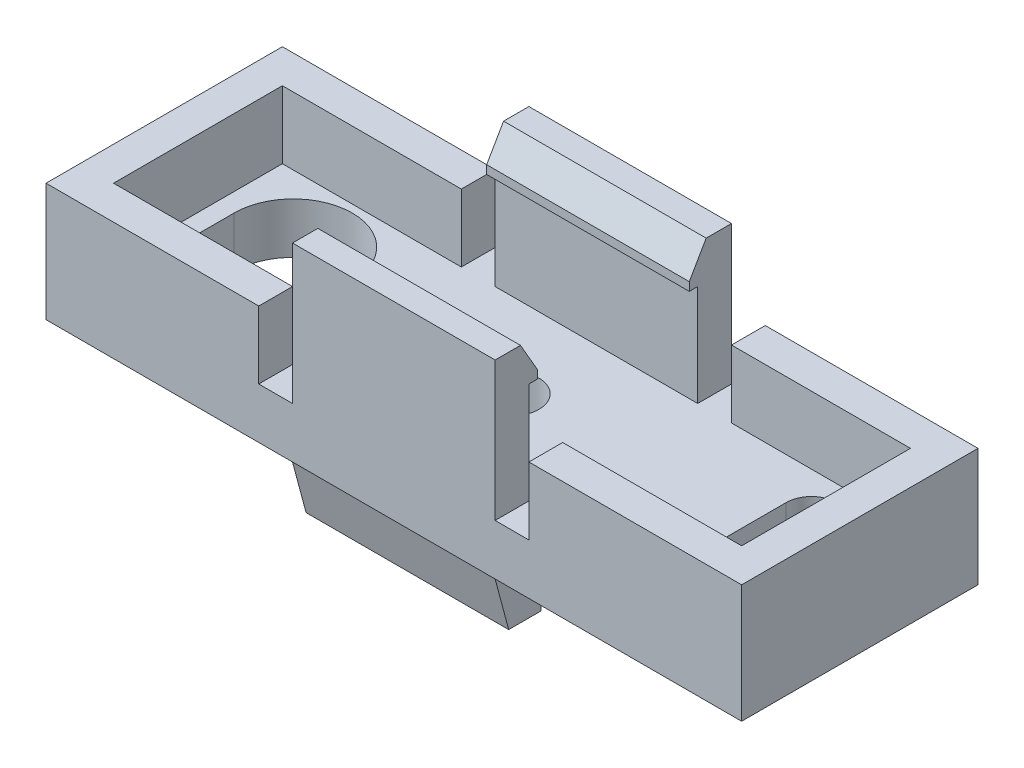
from build123d import *

# Parameters (mm, degrees)
SKETCH1_W           = 20.6
SKETCH1_H           = 7
BOSS_EXTRUDE1_DEPTH = 1.5
SKETCH2_W           = 20.6
SKETCH2_H           = 7
SKETCH2_W_2         = 18.6
SKETCH2_H_2         = 5
BOSS_EXTRUDE2_DEPTH = 2
SKETCH3_W           = 1
SKETCH3_H           = 2
CUT_EXTRUDE1_DEPTH  = 13.935996289
BOSS_EXTRUDE3_DEPTH = 6
CUT_EXTRUDE3_DEPTH  = 12.63106466
BOSS_EXTRUDE4_DEPTH = 3
SKETCH5_R           = 0.8
SKETCH5_R_2         = 0.4
CUT_EXTRUDE2_DEPTH  = 12.63106466


with BuildPart() as part:
    # Sketch1 → Boss-Extrude1 (new body)
    with BuildSketch(Plane(origin=(0, 0, 0), x_dir=(1, 0, 0), z_dir=(0, 1, 0))):
        Rectangle(SKETCH1_W, SKETCH1_H)
    extrude(amount=BOSS_EXTRUDE1_DEPTH)

    # Sketch2 → Boss-Extrude2 (add)
    with BuildSketch(Plane(origin=(0, 1.5, 0), x_dir=(1, 0, 0), z_dir=(0, 1, 0))):
        Rectangle(SKETCH2_W, SKETCH2_H)
        Rectangle(SKETCH2_W_2, SKETCH2_H_2, mode=Mode.SUBTRACT)
    extrude(amount=BOSS_EXTRUDE2_DEPTH)

    # Sketch3 → Cut-Extrude1 (cut, through all)
    with BuildSketch(Plane.XY.offset(3.5)):
        with Locations((3.5, 2.5)):
            Rectangle(SKETCH3_W, SKETCH3_H)
        with Locations((-3.5, 2.5)):
            Rectangle(SKETCH3_W, SKETCH3_H)
    extrude(amount=-CUT_EXTRUDE1_DEPTH, mode=Mode.SUBTRACT)

    # Sketch4 → Boss-Extrude3 (add)
    with BuildSketch(Plane.ZY.offset(3)):
        Polygon((-2.5, 4.5), (-2.25, 4.5), (-2.25, 4.75), (-2.75, 5.616025404), (-3.5, 5.616025404), (-3.5, 3.87609405), (-3.5, 3.5), (-2.5, 3.5), align=None)
    boss_extrude3 = extrude(amount=-BOSS_EXTRUDE3_DEPTH)

    # Mirror1: Boss-Extrude3 across plane
    add(boss_extrude3.mirror(Plane.XY))

    # Sketch6 → Cut-Extrude3 (cut, through all)
    with BuildSketch(Plane(origin=(0, 1.5, 0), x_dir=(1, 0, 0), z_dir=(0, 1, 0))):
        with BuildLine():
            Line((8.35, 1.27), (8.35, -1.27))
            ThreePointArc((8.35, -1.27), (7.6, -2.02), (6.85, -1.27))
            Line((6.85, -1.27), (6.85, 1.27))
            ThreePointArc((6.85, 1.27), (7.6, 2.02), (8.35, 1.27))
        make_face()
        with BuildLine():
            Line((-5.25, 0.52), (-5.25, -0.52))
            ThreePointArc((-5.25, -0.52), (-7, -2.27), (-8.75, -0.52))
            Line((-8.75, -0.52), (-8.75, 0.52))
            ThreePointArc((-8.75, 0.52), (-7, 2.27), (-5.25, 0.52))
        make_face()
    extrude(amount=-CUT_EXTRUDE3_DEPTH, mode=Mode.SUBTRACT)

    # Sketch8 → Boss-Extrude4 (add, symmetric)
    with BuildSketch(Plane(origin=(0, 0, 0), x_dir=(0, 0, -1), z_dir=(1, 0, 0))):
        with BuildLine():
            Line((-3.5, 0), (-3.098076211, -1.5))
            Line((-3.098076211, -1.5), (-2.145, -1.5))
            ThreePointArc((-2.145, -1.5), (-1.27, -0.625), (-0.395, -1.5))
            Line((-0.395, -1.5), (0.87, -1.5))
            Line((0.87, -1.5), (0.87, -1))
            ThreePointArc((0.87, -1), (1.27, -0.6), (1.67, -1))
            Line((1.67, -1), (3.232050808, -1))
            Line((3.232050808, -1), (3.5, 0))
            Line((3.5, 0), (-3.5, 0))
        make_face()
    extrude(amount=BOSS_EXTRUDE4_DEPTH, both=True)

    # Sketch5 → Cut-Extrude2 (cut, through all)
    with BuildSketch(Plane(origin=(0, 1.5, 0), x_dir=(1, 0, 0), z_dir=(0, 1, 0))):
        with Locations(Location((0, 0, 0), (0, 0, 270))):
            Circle(SKETCH5_R)
        with Locations(Location((8.95, -2, 0), (0, 0, 270))):
            Circle(SKETCH5_R_2)
    extrude(amount=-CUT_EXTRUDE2_DEPTH, mode=Mode.SUBTRACT)


solid = part.part
